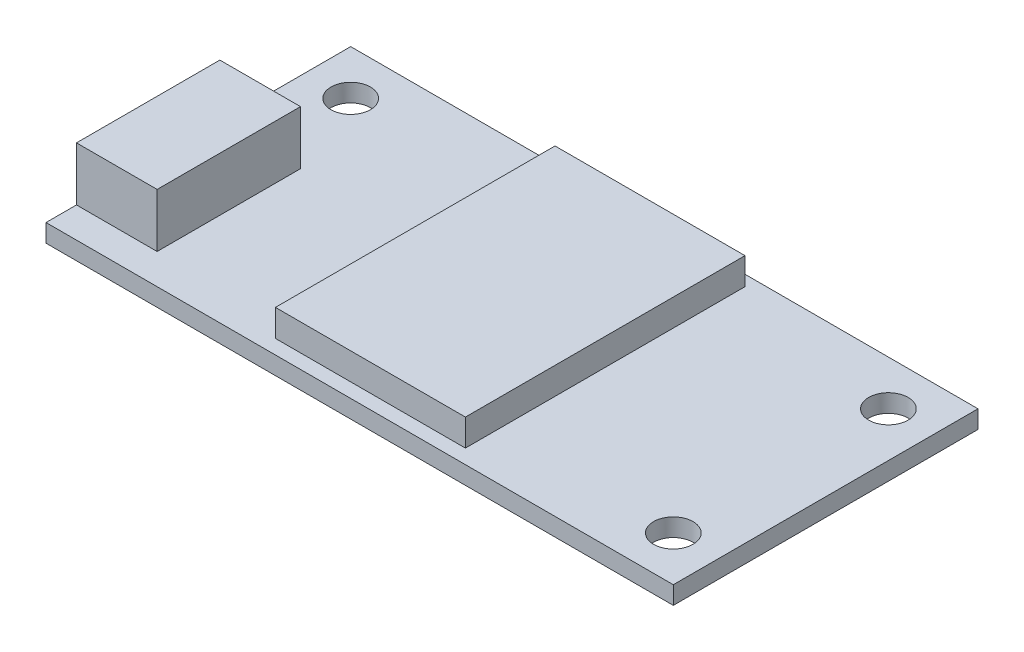
from build123d import *

# Parameters (mm, degrees)
SKETCH1_W               = 35
SKETCH1_H               = 17
BOSS_EXTRUDE1_DEPTH     = 0.5
SKETCH2_W               = 4.5
SKETCH2_H               = 8
BOSS_EXTRUDE2_DEPTH     = 3
SKETCH3_W               = 10.6
SKETCH3_H               = 15.6
BOSS_EXTRUDE3_DEPTH     = 1.5
CUT_EXTRUDE1_DEPTH      = 20.685019685
CUT_EXTRUDE1_DEPTH_BACK = 20.685019685
SKETCH4_R               = 1.1


with BuildPart() as part:
    # Sketch1 → Boss-Extrude1 (new, symmetric)
    with BuildSketch(Plane(origin=(0, 0, 0), x_dir=(1, 0, 0), z_dir=(0, 1, 0))):
        Rectangle(SKETCH1_W, SKETCH1_H)
    extrude(amount=BOSS_EXTRUDE1_DEPTH, both=True)

    # Sketch2 → Boss-Extrude2 (add)
    with BuildSketch(Plane(origin=(0, 0.5, 0), x_dir=(1, 0, 0), z_dir=(0, 1, 0))):
        with Locations((-15.25, -2.8)):
            Rectangle(SKETCH2_W, SKETCH2_H)
    extrude(amount=BOSS_EXTRUDE2_DEPTH)

    # Sketch3 → Boss-Extrude3 (add)
    with BuildSketch(Plane(origin=(0, 0.5, 0), x_dir=(1, 0, 0), z_dir=(0, 1, 0))):
        with Locations((-0.2, 0.1)):
            Rectangle(SKETCH3_W, SKETCH3_H)
    extrude(amount=BOSS_EXTRUDE3_DEPTH)

    # Sketch4 → Cut-Extrude1 (cut, two sides: drawn at the far end of the back side and taken through both)
    with BuildSketch(Plane(origin=(0, 0.5, 0), x_dir=(1, 0, 0), z_dir=(0, 1, 0)).offset(-CUT_EXTRUDE1_DEPTH_BACK)):
        with Locations(Location((15, 6, 0), (0, 0, 270))):
            Circle(SKETCH4_R)
        with Locations(Location((15, -6, 0), (0, 0, 270))):
            Circle(SKETCH4_R)
        with Locations(Location((-15, 6, 0), (0, 0, 270))):
            Circle(SKETCH4_R)
    extrude(amount=CUT_EXTRUDE1_DEPTH + CUT_EXTRUDE1_DEPTH_BACK, mode=Mode.SUBTRACT)


solid = part.part
